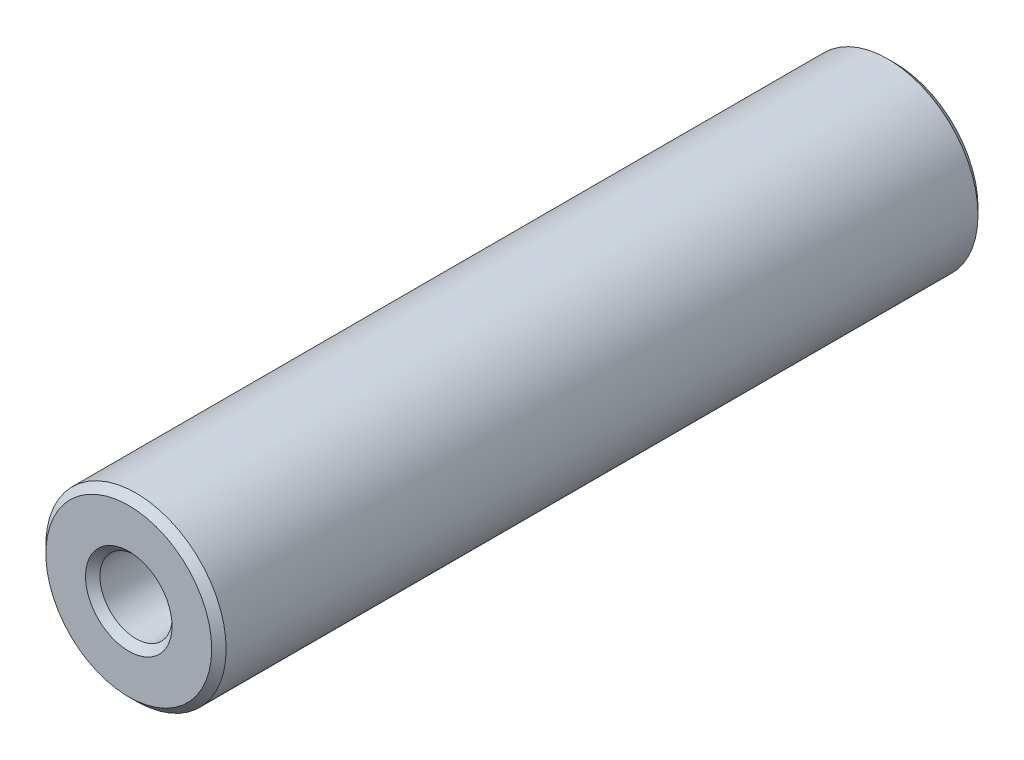
from build123d import *

# Parameters (mm, degrees)
SKETCH1_R           = 6.35
SKETCH1_R_2         = 2.54
BOSS_EXTRUDE1_DEPTH = 53.975
CHAMFER1_SIZE       = 0.508


with BuildPart() as part:
    # Sketch1 → Boss-Extrude1 (new body)
    with BuildSketch(Plane.XY):
        Circle(SKETCH1_R)
        Circle(SKETCH1_R_2, mode=Mode.SUBTRACT)
    extrude(amount=BOSS_EXTRUDE1_DEPTH)

    # Chamfer1
    chamfer1_edges = [part.edges().sort_by_distance(p)[0] for p in [
        (-6.35, 0, 0),
        (-6.35, 0, 53.975),
        (-2.54, 0, 0),
        (-2.54, 0, 53.975),
    ]]
    chamfer(chamfer1_edges, length=CHAMFER1_SIZE)


solid = part.part
